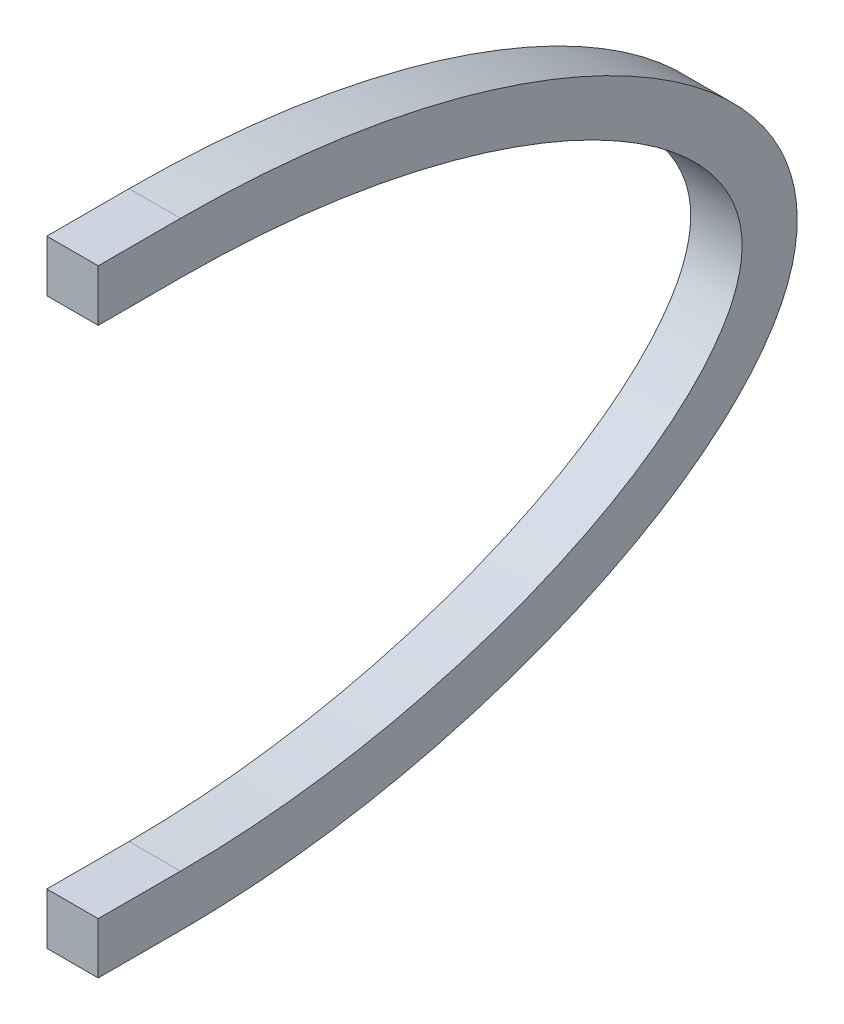
from build123d import *

# Parameters (mm, degrees)
SKETCH1_W           = 8
SKETCH1_H           = 5.019775672
SKETCH1_H_2         = 5.000079272
BOSS_EXTRUDE1_DEPTH = 2.5


with BuildPart() as part:
    # Sketch1 → Boss-Extrude1 (new, symmetric)
    with BuildSketch(Plane(origin=(0, 0, 0), x_dir=(0, 0, -1), z_dir=(1, 0, 0))):
        with Locations((-4, 27.499960364)):
            Rectangle(SKETCH1_W, SKETCH1_H)
        with BuildLine():
            add(Edge.make_bspline(
                [(0, 30.0098482), (29.777837141, 30.0098482), (59.944698768, 15.724870112), (60.57082784, -15.453928663), (27.842412116, -29.9901518), (0, -29.9901518)],
                knots=[0, 0, 0, 0, 0.453231819, 0.553231819, 1, 1, 1, 1], degree=3))
            Line((0, 30.0098482), (0, 24.990072528))
            add(Edge.make_bspline(
                [(0, 24.990072528), (30.140729333, 24.990072528), (80.214114902, 0), (27.96337618, -24.990072528), (0, -24.990072528)],
                knots=[0, 0, 0, 0, 0.5, 1, 1, 1, 1], degree=3))
            Line((0, -24.990072528), (0, -29.9901518))
        make_face()
        with Locations((-4, -27.490112164)):
            Rectangle(SKETCH1_W, SKETCH1_H_2)
    extrude(amount=BOSS_EXTRUDE1_DEPTH, both=True)


solid = part.part
